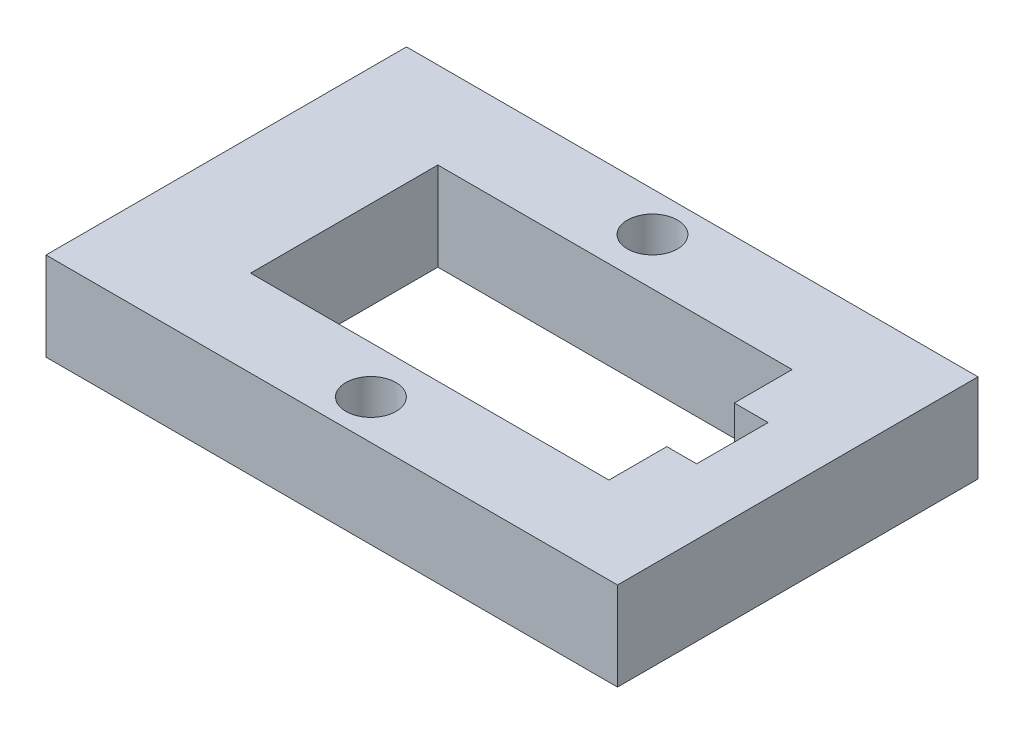
from build123d import *

# Parameters (mm, degrees)
SKETCH2_W           = 38.75194
SKETCH2_H           = 24.44303
SKETCH2_R           = 1.7
BOSS_EXTRUDE1_DEPTH = 3


with BuildPart() as part:
    # Sketch2 → Boss-Extrude1 (new, symmetric)
    with BuildSketch(Plane(origin=(0, 0, 0), x_dir=(1, 0, 0), z_dir=(0, 1, 0))):
        with Locations((-1.253031638, 1.410566346)):
            Rectangle(SKETCH2_W, SKETCH2_H)
        with Locations(Location((-1.272682118, 10.954361346, 0), (0, 0, 270))):
            Circle(SKETCH2_R, mode=Mode.SUBTRACT)
        with Locations(Location((-1.277061638, -8.130948654, 0), (0, 0, 270))):
            Circle(SKETCH2_R, mode=Mode.SUBTRACT)
        Polygon((-12.629001638, 7.759051346), (11.395558827, 7.759051346), (11.395558827, 3.833946346), (13.692948362, 3.833946346), (13.692948362, -1.015843654), (11.670998362, -1.015843654), (11.670998362, -4.940948654), (-12.629001638, -4.940948654), align=None, mode=Mode.SUBTRACT)
    extrude(amount=BOSS_EXTRUDE1_DEPTH, both=True)


solid = part.part
